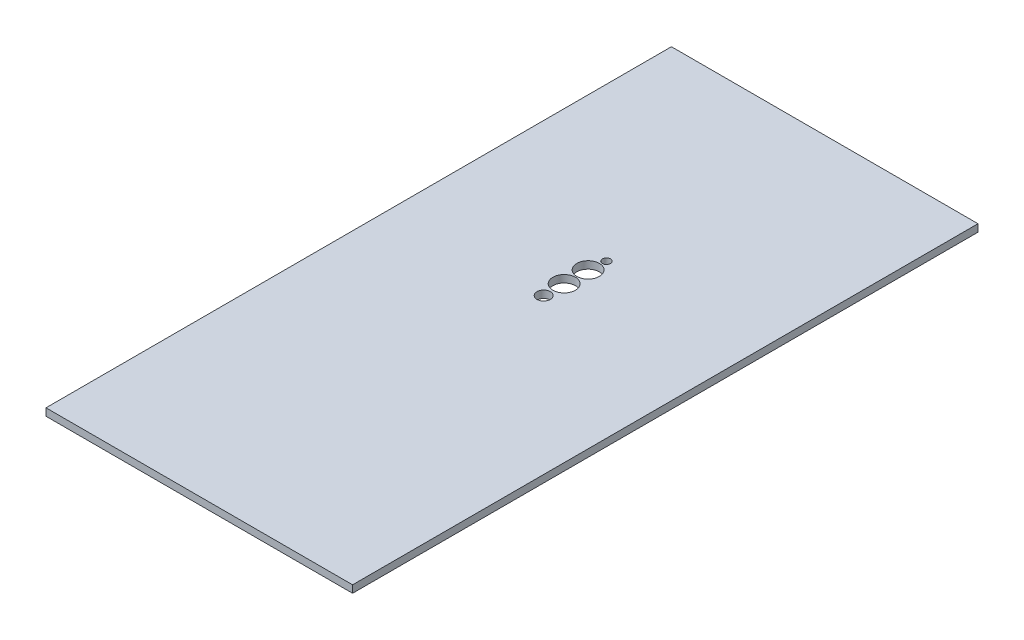
from build123d import *

# Parameters (mm, degrees)
ESBO_O1_W                = 250
ESBO_O1_H                = 475
RESSALTO_EXTRUS_O1_DEPTH = 6
ESBO_O2_W                = 250
ESBO_O2_H                = 6
RESSALTO_EXTRUS_O2_DEPTH = 25
ESBO_O3_W                = 250
ESBO_O3_H                = 6
RESSALTO_EXTRUS_O4_DEPTH = 80
ESBO_O4_W                = 250
ESBO_O4_H                = 6
CORTE_EXTRUS_O1_DEPTH    = 70
ESBO_O5_R                = 3.3
ESBO_O5_R_2              = 9.2
ESBO_O5_R_3              = 5.5
CORTE_EXTRUS_O3_DEPTH    = 537.806296535


with BuildPart() as part:
    # Esboço1 → Ressalto-extrusão1 (new body)
    with BuildSketch(Plane(origin=(0, 0, 0), x_dir=(1, 0, 0), z_dir=(0, 1, 0))):
        with Locations((125, -237.5)):
            Rectangle(ESBO_O1_W, ESBO_O1_H)
    extrude(amount=RESSALTO_EXTRUS_O1_DEPTH)

    # Esboço2 → Ressalto-extrusão2 (add)
    with BuildSketch(Plane(origin=(0, 0, 0), x_dir=(-1, 0, 0), z_dir=(0, 0, -1))):
        with Locations((-125, 3)):
            Rectangle(ESBO_O2_W, ESBO_O2_H)
    extrude(amount=RESSALTO_EXTRUS_O2_DEPTH)

    # Esboço3 → Ressalto-extrusão4 (add)
    with BuildSketch(Plane(origin=(0, 0, -25), x_dir=(-1, 0, 0), z_dir=(0, 0, -1))):
        with Locations((-125, 3)):
            Rectangle(ESBO_O3_W, ESBO_O3_H)
    extrude(amount=RESSALTO_EXTRUS_O4_DEPTH)

    # Esboço4 → Corte-extrusão1 (cut)
    with BuildSketch(Plane(origin=(0, 0, -105), x_dir=(-1, 0, 0), z_dir=(0, 0, -1))):
        with Locations((-125, 3)):
            Rectangle(ESBO_O4_W, ESBO_O4_H)
    extrude(amount=-CORTE_EXTRUS_O1_DEPTH, mode=Mode.SUBTRACT)

    # Esboço5 → Corte-extrusão3 (cut, through all)
    with BuildSketch(Plane(origin=(0, 6, 0), x_dir=(1, 0, 0), z_dir=(0, 1, 0))):
        with Locations(Location((125, -142.97362902, 0), (0, 0, 270))):
            Circle(ESBO_O5_R)
        with Locations(Location((123.645994784, -156.588756812, 0), (0, 0, 270))):
            Circle(ESBO_O5_R_2)
        with Locations(Location((123.645994784, -192.796164786, 0), (0, 0, 270))):
            Circle(ESBO_O5_R_3)
        with Locations(Location((123.645994784, -176.121700588, 0), (0, 0, 270))):
            Circle(ESBO_O5_R_2)
    extrude(amount=-CORTE_EXTRUS_O3_DEPTH, mode=Mode.SUBTRACT)


solid = part.part
